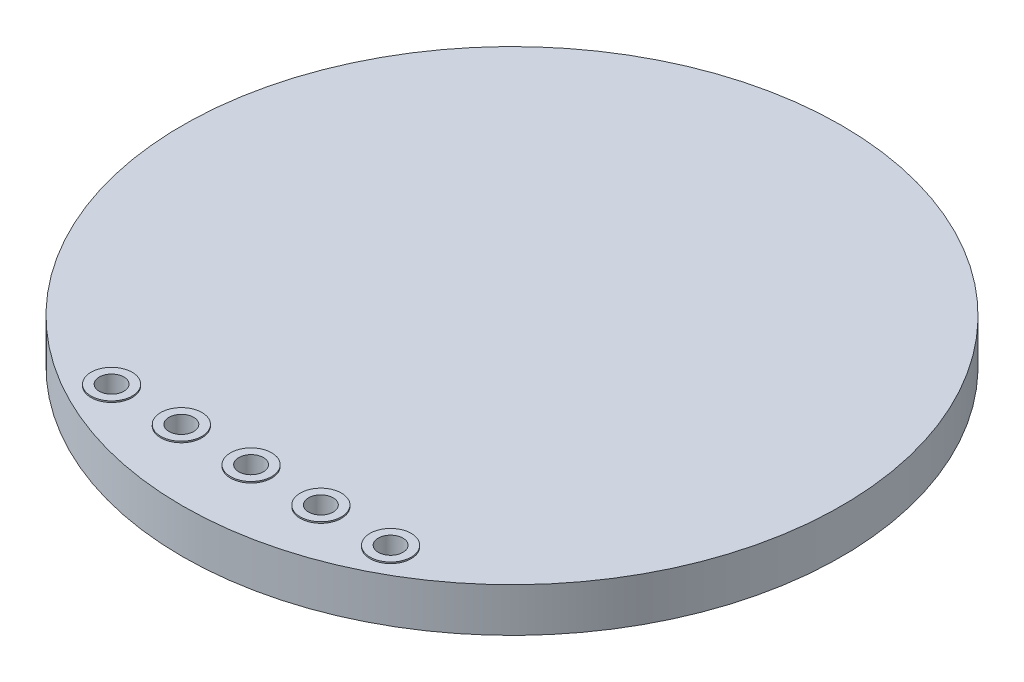
from build123d import *

# Parameters (mm, degrees)
SCHIZZO1_R                   = 12
ESTRUSIONE_ESTRUSIONE1_DEPTH = 0.8
SCHIZZO2_R                   = 0.45
TAGLIO_ESTRUSIONE1_DEPTH     = 18.045820602
SCHIZZO3_R                   = 0.75
SCHIZZO3_R_2                 = 0.45
ESTRUSIONE_ESTRUSIONE2_DEPTH = 0.05


with BuildPart() as part:
    # Schizzo1 → Estrusione-Estrusione1 (new, symmetric)
    with BuildSketch(Plane(origin=(0, 0, 0), x_dir=(1, 0, 0), z_dir=(0, 1, 0))):
        with Locations(Location((0, 0, 0), (0, 0, 270))):
            Circle(SCHIZZO1_R)
    extrude(amount=ESTRUSIONE_ESTRUSIONE1_DEPTH, both=True)

    # Schizzo2 → Taglio-Estrusione1 (cut, through all)
    with BuildSketch(Plane(origin=(0, 0.8, 0), x_dir=(1, 0, 0), z_dir=(0, 1, 0))):
        with Locations(Location((0, -9.5, 0), (0, 0, 270))):
            Circle(SCHIZZO2_R)
        with Locations(Location((2.54, -9.5, 0), (0, 0, 270))):
            Circle(SCHIZZO2_R)
        with Locations(Location((5.08, -9.5, 0), (0, 0, 270))):
            Circle(SCHIZZO2_R)
        with Locations(Location((-2.54, -9.5, 0), (0, 0, 270))):
            Circle(SCHIZZO2_R)
        with Locations(Location((-5.08, -9.5, 0), (0, 0, 270))):
            Circle(SCHIZZO2_R)
    extrude(amount=-TAGLIO_ESTRUSIONE1_DEPTH, mode=Mode.SUBTRACT)

    # Schizzo3 → Estrusione-Estrusione2 (add, symmetric)
    # profile 1 of 5: a face of its own
    with BuildSketch(Plane(origin=(0, 0.8, 0), x_dir=(1, 0, 0), z_dir=(0, 1, 0))):
        with Locations(Location((-5.08, -9.5, 0), (0, 0, 270))):
            Circle(SCHIZZO3_R)
        with Locations(Location((-5.08, -9.5, 0), (0, 0, 270))):
            Circle(SCHIZZO3_R_2, mode=Mode.SUBTRACT)
    # profile 2 of 5: a face of its own
    with BuildSketch(Plane(origin=(0, 0.8, 0), x_dir=(1, 0, 0), z_dir=(0, 1, 0))):
        with Locations(Location((-2.54, -9.5, 0), (0, 0, 270))):
            Circle(SCHIZZO3_R)
        with Locations(Location((-2.54, -9.5, 0), (0, 0, 270))):
            Circle(SCHIZZO3_R_2, mode=Mode.SUBTRACT)
    # profile 3 of 5: a face of its own
    with BuildSketch(Plane(origin=(0, 0.8, 0), x_dir=(1, 0, 0), z_dir=(0, 1, 0))):
        with Locations(Location((0, -9.5, 0), (0, 0, 270))):
            Circle(SCHIZZO3_R)
        with Locations(Location((0, -9.5, 0), (0, 0, 270))):
            Circle(SCHIZZO3_R_2, mode=Mode.SUBTRACT)
    # profile 4 of 5: a face of its own
    with BuildSketch(Plane(origin=(0, 0.8, 0), x_dir=(1, 0, 0), z_dir=(0, 1, 0))):
        with Locations(Location((2.54, -9.5, 0), (0, 0, 270))):
            Circle(SCHIZZO3_R)
        with Locations(Location((2.54, -9.5, 0), (0, 0, 270))):
            Circle(SCHIZZO3_R_2, mode=Mode.SUBTRACT)
    # profile 5 of 5: a face of its own
    with BuildSketch(Plane(origin=(0, 0.8, 0), x_dir=(1, 0, 0), z_dir=(0, 1, 0))):
        with Locations(Location((5.08, -9.5, 0), (0, 0, 270))):
            Circle(SCHIZZO3_R)
        with Locations(Location((5.08, -9.5, 0), (0, 0, 270))):
            Circle(SCHIZZO3_R_2, mode=Mode.SUBTRACT)
    estrusione_estrusione2 = extrude(amount=ESTRUSIONE_ESTRUSIONE2_DEPTH, both=True)

    # Specchia1: Estrusione-Estrusione2 across plane
    add(estrusione_estrusione2.mirror(Plane.ZX))


solid = part.part
